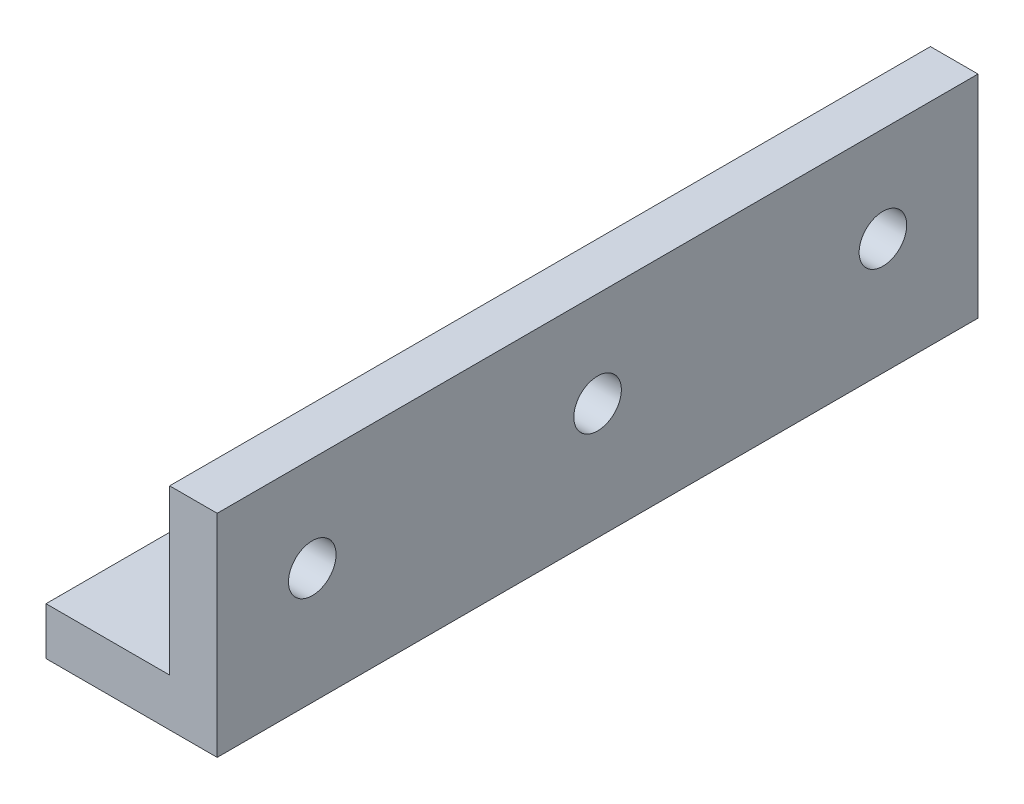
from build123d import *

# Parameters (mm, degrees)
SKETCH1_W           = 22.86
SKETCH1_H           = 101.6
BOSS_EXTRUDE1_DEPTH = 6.35
SKETCH2_W           = 6.35
SKETCH2_H           = 101.6
BOSS_EXTRUDE2_DEPTH = 21.88544518
SKETCH3_R           = 3.175
CUT_EXTRUDE1_DEPTH  = 6.35
SKETCH4_R           = 3.175
CUT_EXTRUDE2_DEPTH  = 6.35


with BuildPart() as part:
    # Sketch1 → Boss-Extrude1 (new body)
    with BuildSketch(Plane(origin=(0, 0, 0), x_dir=(1, 0, 0), z_dir=(0, 1, 0))):
        with Locations((25.30485342, -29.454071661)):
            Rectangle(SKETCH1_W, SKETCH1_H)
    extrude(amount=BOSS_EXTRUDE1_DEPTH)

    # Sketch2 → Boss-Extrude2 (add)
    with BuildSketch(Plane(origin=(0, 6.35, 0), x_dir=(1, 0, 0), z_dir=(0, 1, 0))):
        with Locations((33.55985342, -29.454071661)):
            Rectangle(SKETCH2_W, SKETCH2_H)
    extrude(amount=BOSS_EXTRUDE2_DEPTH)

    # Sketch3 → Cut-Extrude1 (cut)
    with BuildSketch(Plane.ZY.offset(-30.38485342)):
        with Locations((67.554071661, 15.53544518)):
            Circle(SKETCH3_R)
        with Locations((29.454071661, 15.53544518)):
            Circle(SKETCH3_R)
        with Locations((-8.645928339, 15.53544518)):
            Circle(SKETCH3_R)
    extrude(amount=-CUT_EXTRUDE1_DEPTH, mode=Mode.SUBTRACT)

    # Sketch4 → Cut-Extrude2 (cut)
    with BuildSketch(Plane(origin=(0, 6.35, 0), x_dir=(1, 0, 0), z_dir=(0, 1, 0))):
        with Locations(Location((24.03485342, -48.504071661, 0), (0, 0, 270))):
            Circle(SKETCH4_R)
        with Locations(Location((24.03485342, -10.404071661, 0), (0, 0, 270))):
            Circle(SKETCH4_R)
    extrude(amount=-CUT_EXTRUDE2_DEPTH, mode=Mode.SUBTRACT)


solid = part.part
